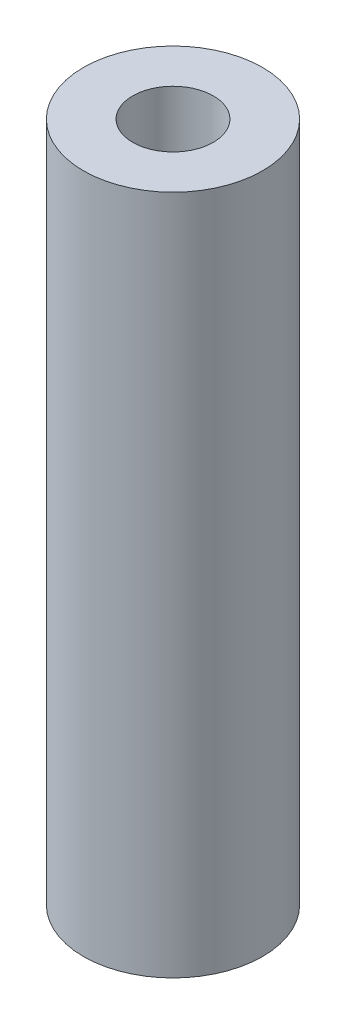
from build123d import *

# Parameters (mm, degrees)
CROQUIS1_R                   = 5
SALIENTE_EXTRUIR1_DEPTH      = 19
TALADRO_DE_MARGEN_PARA_M41_D = 4.5


with BuildPart() as part:
    # Croquis1 → Saliente-Extruir1 (new, symmetric)
    with BuildSketch(Plane(origin=(0, 0, 0), x_dir=(1, 0, 0), z_dir=(0, 1, 0))):
        with Locations(Location((0, 0, 0), (0, 0, 270))):
            Circle(CROQUIS1_R)
    extrude(amount=SALIENTE_EXTRUIR1_DEPTH, both=True)

    # Taladro de margen para M41 (through all)
    with Locations(Plane(origin=(0, 19, 0), x_dir=(1, 0, 0), z_dir=(0, 1, 0))):
        with Locations((0, 0)):
            Hole(TALADRO_DE_MARGEN_PARA_M41_D / 2)


solid = part.part
